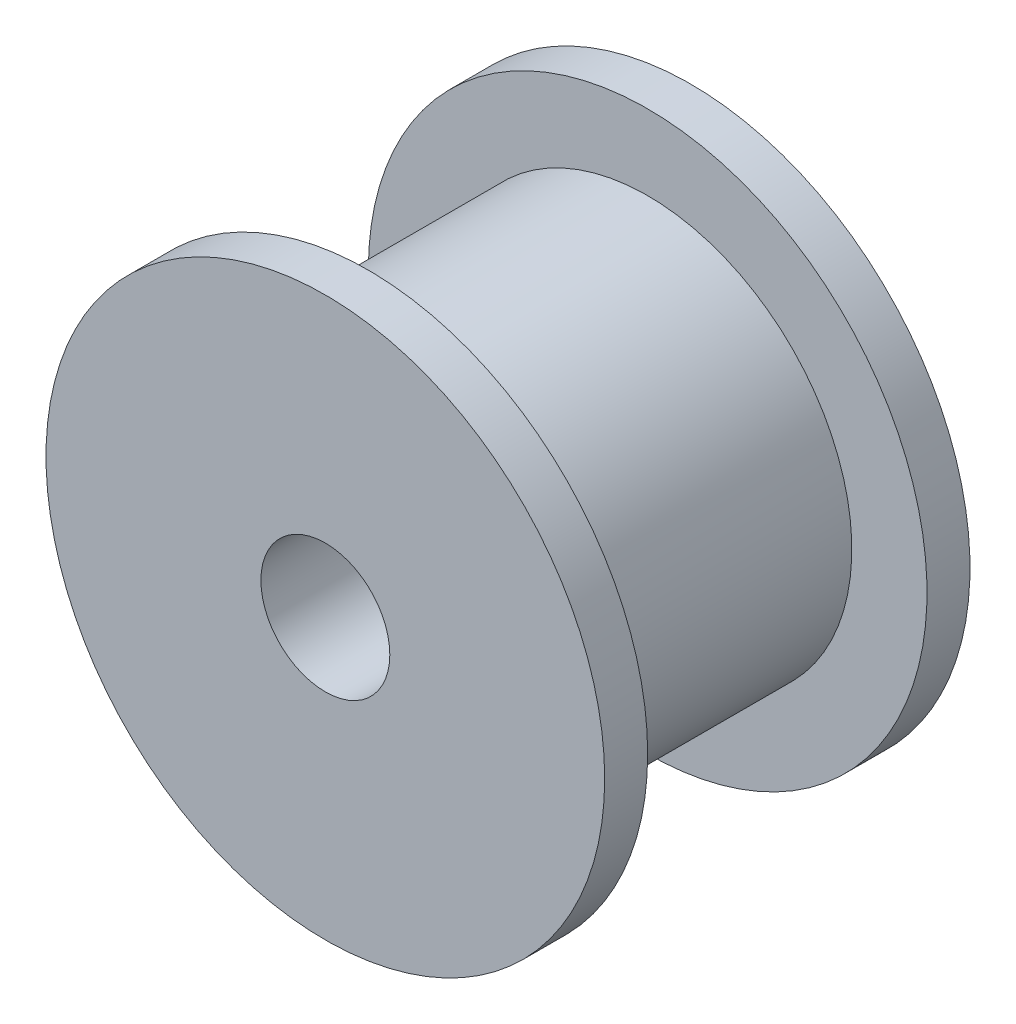
from build123d import *

# Parameters (mm, degrees)
SKETCH_1_R          = 4.75
EXTRUDE_1_DEPTH     = 8.5
SKETCH_2_R          = 6.5
EXTRUDE_2_DEPTH     = 1
EXTRUDE_START       = -1
SKETCH_3_R          = 6.5
EXTRUDE_3_DEPTH     = 1
SKETCH_4_R          = 1.5
CUT_EXTRUDE_1_DEPTH = 12


with BuildPart() as part:
    # 草图1 → 凸台-拉伸1 (new body)
    with BuildSketch(Plane.XY):
        Circle(SKETCH_1_R)
    extrude(amount=EXTRUDE_1_DEPTH)

    # 草图2 → 凸台-拉伸2 (add)
    with BuildSketch(Plane.XY.offset(8.5)):
        Circle(SKETCH_2_R)
    extrude(amount=-EXTRUDE_2_DEPTH)

    # 草图3 → 凸台-拉伸3 (add)
    with BuildSketch(Plane(origin=(0, 0, 0), x_dir=(-1, 0, 0), z_dir=(0, 0, -1)).offset(EXTRUDE_START)):
        with Locations(Location((0, 0, 0), (0, 0, 180))):
            Circle(SKETCH_3_R)
    extrude(amount=EXTRUDE_3_DEPTH)

    # 草图4 → 切除-拉伸1 (cut)
    with BuildSketch(Plane(origin=(0, 0, 0), x_dir=(-1, 0, 0), z_dir=(0, 0, -1))):
        Circle(SKETCH_4_R)
    extrude(amount=-CUT_EXTRUDE_1_DEPTH, mode=Mode.SUBTRACT)


solid = part.part
